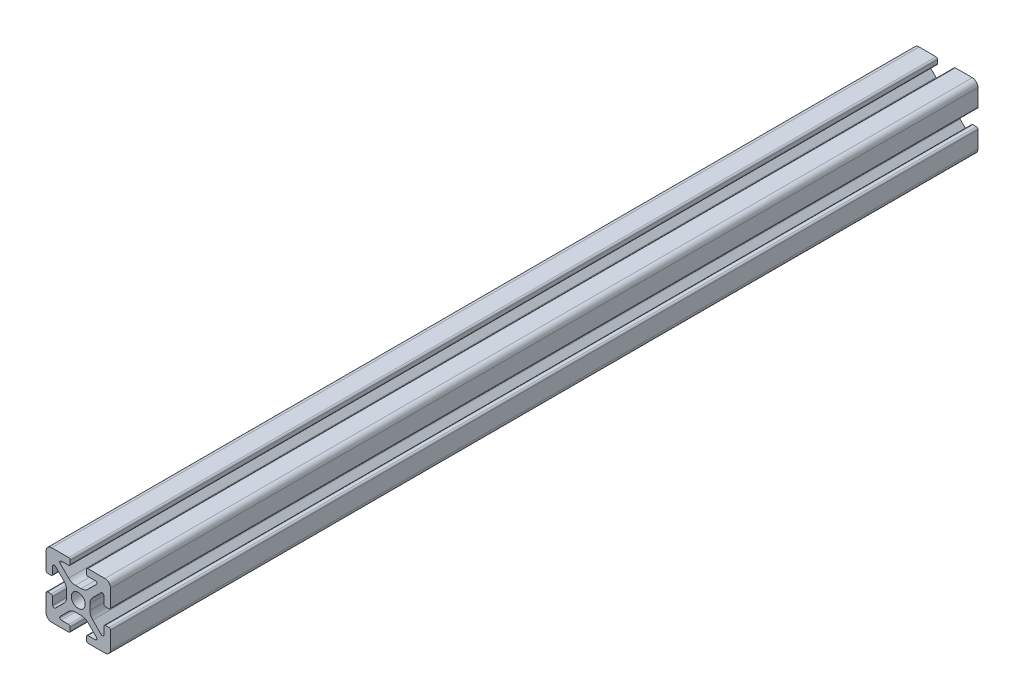
from build123d import *

# Parameters (mm, degrees)
BOSS_EXTRUDE1_DEPTH = 135.5
SKETCH5_W           = 27.787302718
SKETCH5_H           = 26.03929452
CUT_EXTRUDE1_DEPTH  = 2.4


with BuildPart() as part:
    # Sketch4 → Boss-Extrude1 (new, symmetric)
    with BuildSketch(Plane.XY):
        with BuildLine():
            Line((3, -10), (8.25, -10))
            ThreePointArc((8.25, -10), (9.487436867, -9.487436867), (10, -8.25))
            Line((10, -8.25), (10, -3))
            ThreePointArc((10, -3), (9.853553391, -2.646446609), (9.5, -2.5))
            Line((9.5, -2.5), (8.424621202, -2.5))
            ThreePointArc((8.424621202, -2.5), (8.071067812, -2.646446609), (7.924621202, -3))
            Line((7.924621202, -3), (7.924621202, -5.25))
            ThreePointArc((7.924621202, -5.25), (7.615962919, -5.711939766), (7.071067812, -5.603553391))
            Line((7.071067812, -5.603553391), (4.478679656, -3.011165235))
            ThreePointArc((4.478679656, -3.011165235), (3.828361402, -2.037895189), (3.6, -0.889844892))
            Line((3.6, -0.889844892), (3.6, 0))
            Line((3.6, 0), (2.15, 0))
            ThreePointArc((2.15, 0), (1.52027958, -1.52027958), (0, -2.15))
            Line((0, -2.15), (0, -3.6))
            Line((0, -3.6), (0.889844892, -3.6))
            ThreePointArc((0.889844892, -3.6), (2.037895189, -3.828361402), (3.011165235, -4.478679656))
            Line((3.011165235, -4.478679656), (5.603553391, -7.071067812))
            ThreePointArc((5.603553391, -7.071067812), (5.711939766, -7.615962919), (5.25, -7.924621202))
            Line((5.25, -7.924621202), (3, -7.924621202))
            ThreePointArc((3, -7.924621202), (2.646446609, -8.071067812), (2.5, -8.424621202))
            Line((2.5, -8.424621202), (2.5, -9.5))
            ThreePointArc((2.5, -9.5), (2.646446609, -9.853553391), (3, -10))
        make_face()
    extrude(amount=BOSS_EXTRUDE1_DEPTH, both=True)

    # Mirror1: part across plane


with BuildPart() as part_1:
    add(part.part)
    add(part.part.mirror(Plane(origin=(0, 0, 0), x_dir=(0, 0, 1), z_dir=(1, 0, 0))))

    # Mirror2: part across plane


with BuildPart() as part_2:
    add(part_1.part)
    add(part_1.part.mirror(Plane.ZX))

    # Sketch5 → Cut-Extrude1 (cut)
    with BuildSketch(Plane.XY.offset(135.5)):
        with Locations((-0.060276145, -0.663037592)):
            Rectangle(SKETCH5_W, SKETCH5_H)
    extrude(amount=-CUT_EXTRUDE1_DEPTH, mode=Mode.SUBTRACT)


solid = part_2.part
